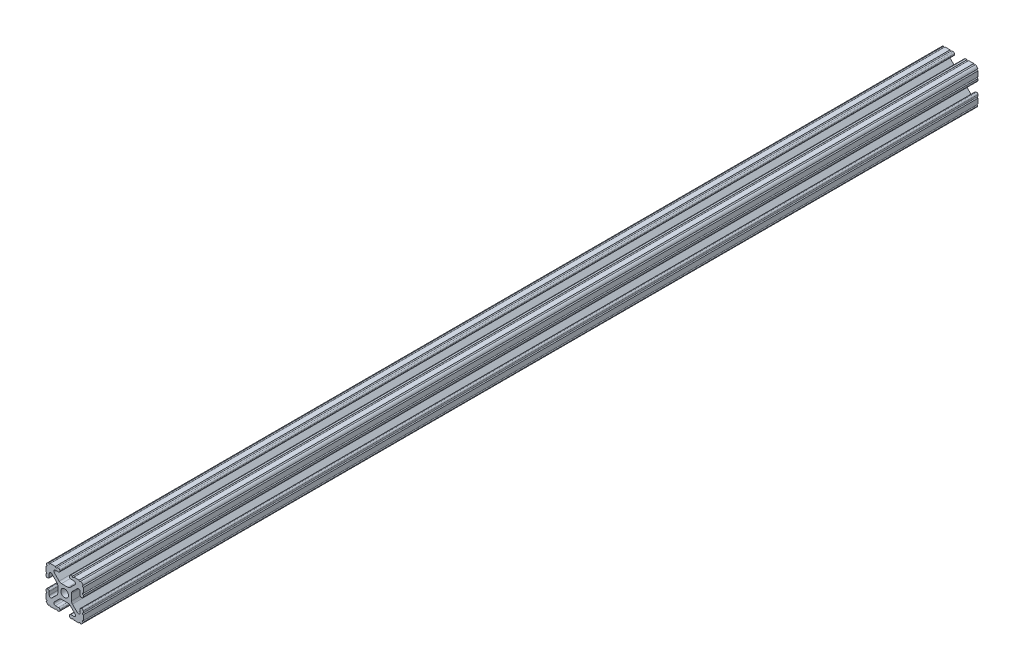
from build123d import *

# Parameters (mm, degrees)
BOSS_EXTRUDE1_DEPTH     = 304.8
CUT_EXTRUDE1_DEPTH      = 306.328708116
CUT_EXTRUDE1_DEPTH_BACK = 306.328708116
SKETCH5_R               = 0.55245
CUT_EXTRUDE2_DEPTH      = 31.496
CUT_EXTRUDE2_DEPTH_BACK = 71.628
SKETCH6_R               = 2.6035


with BuildPart() as part:
    # Sketch4 → Boss-Extrude1 (new, symmetric)
    with BuildSketch(Plane.XY):
        with BuildLine():
            Line((4.190365, -12.7), (10.11729625, -12.7))
            ThreePointArc((10.11729625, -12.7), (11.943543585, -11.943543585), (12.7, -10.11729625))
            Line((12.7, -10.11729625), (12.7, -4.190365))
            ThreePointArc((12.7, -4.190365), (12.42492494, -3.52627506), (11.760835, -3.2512))
            Line((11.760835, -3.2512), (11.429365, -3.2512))
            ThreePointArc((11.429365, -3.2512), (10.76527506, -3.52627506), (10.4902, -4.190365))
            Line((10.4902, -4.190365), (10.4902, -6.348478019))
            ThreePointArc((10.4902, -6.348478019), (9.830707141, -7.335478831), (8.666460301, -7.103895736))
            Line((8.666460301, -7.103895736), (5.299899128, -3.737334563))
            ThreePointArc((5.299899128, -3.737334563), (4.817571085, -3.015479634), (4.6482, -2.16399369))
            Line((4.6482, -2.16399369), (4.6482, 0))
            Line((4.6482, 0), (2.6035, 0))
            ThreePointArc((2.6035, 0), (1.840952505, -1.840952505), (0, -2.6035))
            Line((0, -2.6035), (0, -4.6482))
            Line((0, -4.6482), (2.16399369, -4.6482))
            ThreePointArc((2.16399369, -4.6482), (3.015479634, -4.817571085), (3.737334563, -5.299899128))
            Line((3.737334563, -5.299899128), (7.103895736, -8.666460301))
            ThreePointArc((7.103895736, -8.666460301), (7.335478831, -9.830707141), (6.348478019, -10.4902))
            Line((6.348478019, -10.4902), (4.190365, -10.4902))
            ThreePointArc((4.190365, -10.4902), (3.52627506, -10.76527506), (3.2512, -11.429365))
            Line((3.2512, -11.429365), (3.2512, -11.760835))
            ThreePointArc((3.2512, -11.760835), (3.52627506, -12.42492494), (4.190365, -12.7))
        make_face()
    extrude(amount=BOSS_EXTRUDE1_DEPTH, both=True)

    # Sketch5 → Cut-Extrude1 (cut, two sides: drawn at the far end of the back side and taken through both)
    with BuildSketch(Plane.XY.offset(-CUT_EXTRUDE1_DEPTH_BACK)):
        with Locations((10.356153152, -12.7)):
            Circle(SKETCH5_R)
        with Locations((5.796028019, -12.7)):
            Circle(SKETCH5_R)
        with Locations((12.7, -10.356153152)):
            Circle(SKETCH5_R)
        with Locations((12.7, -5.796028019)):
            Circle(SKETCH5_R)
    extrude(amount=CUT_EXTRUDE1_DEPTH + CUT_EXTRUDE1_DEPTH_BACK, mode=Mode.SUBTRACT)

    # Mirror1: part across plane


with BuildPart() as part_1:
    add(part.part)
    add(part.part.mirror(Plane(origin=(0, 0, 0), x_dir=(0, 0, 1), z_dir=(1, 0, 0))))

    # Mirror2: part across plane


with BuildPart() as part_2:
    add(part_1.part)
    add(part_1.part.mirror(Plane.ZX))

    # Sketch6 → Cut-Extrude2 (cut, two sides: drawn at the far end of the back side and taken through both)
    with BuildSketch(Plane(origin=(0, 4.6482, 0), x_dir=(1, 0, 0), z_dir=(0, 1, 0)).offset(-CUT_EXTRUDE2_DEPTH_BACK)):
        with Locations(Location((0, 127, 0), (0, 0, 33.779200511))):
            Circle(SKETCH6_R)
        with Locations(Location((0, 50.8, 0), (0, 0, 33.779200511))):
            Circle(SKETCH6_R)
        with Locations(Location((0, -279.4, 0), (0, 0, 33.779200511))):
            Circle(SKETCH6_R)
    extrude(amount=CUT_EXTRUDE2_DEPTH + CUT_EXTRUDE2_DEPTH_BACK, mode=Mode.SUBTRACT)


solid = part_2.part
